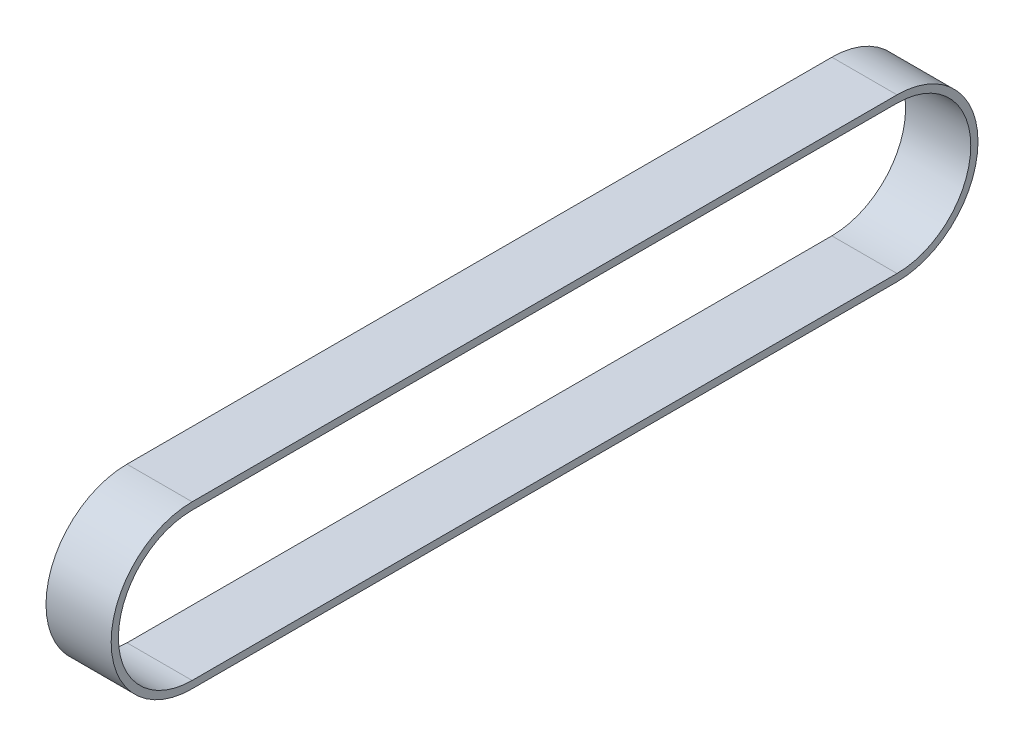
from build123d import *

# Parameters (mm, degrees)
EXTRUDE_THIN1_DEPTH = 4.5


with BuildPart() as part:
    # Sketch1 → Extrude-Thin1 (new, symmetric)
    with BuildSketch(Plane(origin=(0, 0, 0), x_dir=(0, 0, -1), z_dir=(1, 0, 0))):
        with BuildLine():
            Line((-97.36128617, 11.185), (0, 11.185))
            ThreePointArc((0, 11.185), (11.185, 0), (0, -11.185))
            Line((0, -11.185), (-97.36128617, -11.185))
            ThreePointArc((-97.36128617, -11.185), (-108.54628617, 0), (-97.36128617, 11.185))
        make_face()
        with BuildLine():
            Line((-97.36128617, 10.185), (0, 10.185))
            ThreePointArc((0, 10.185), (10.185, 0), (0, -10.185))
            Line((0, -10.185), (-97.36128617, -10.185))
            ThreePointArc((-97.36128617, -10.185), (-107.54628617, 0), (-97.36128617, 10.185))
        make_face(mode=Mode.SUBTRACT)
    extrude(amount=EXTRUDE_THIN1_DEPTH, both=True)


solid = part.part
